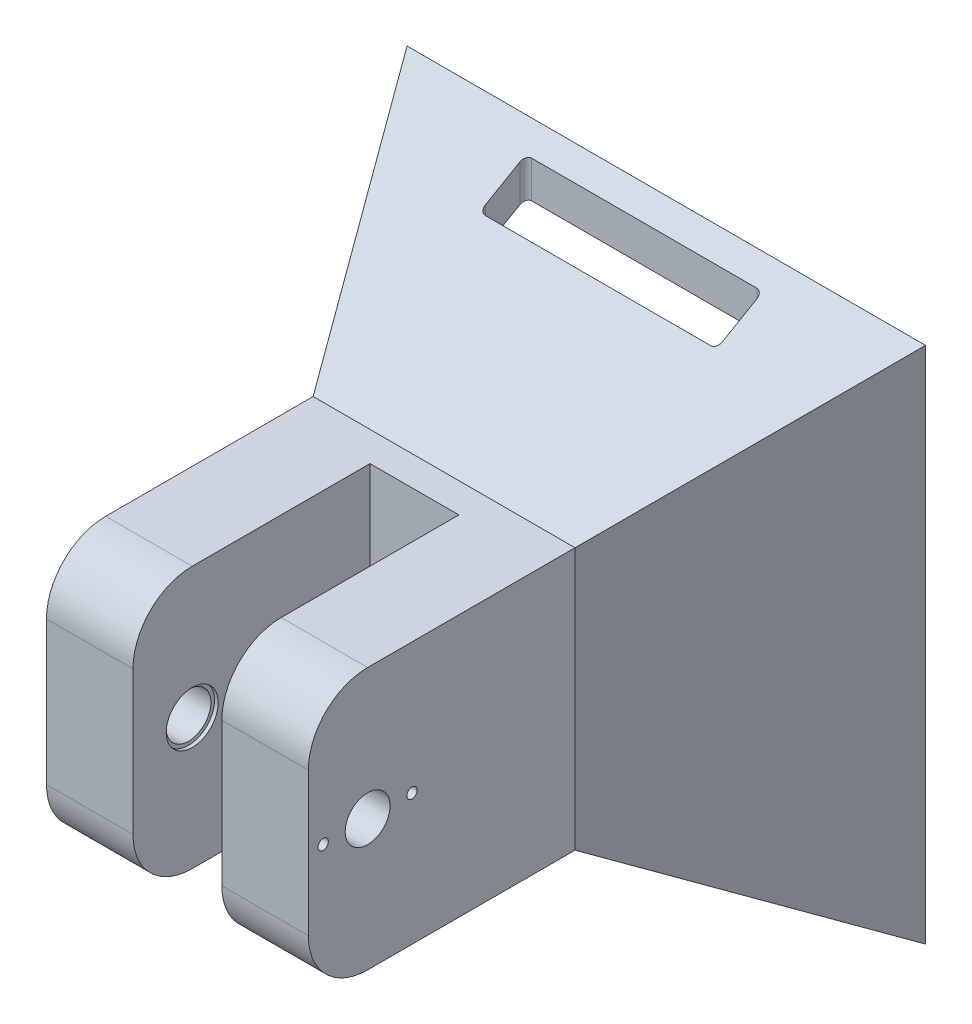
from build123d import *

# Parameters (mm, degrees)
SKETCH2_W           = 175
SKETCH2_H           = 175
BOSS_EXTRUDE1_DEPTH = 75
BOSS_EXTRUDE1_TAPER = 30
SKETCH3_W           = 88.397459622
SKETCH3_H           = 88.397459622
BOSS_EXTRUDE2_DEPTH = 90
SKETCH4_W           = 30
SKETCH4_H           = 88.397459622
CUT_EXTRUDE1_DEPTH  = 80
FILLET1_R           = 20
CUT_EXTRUDE2_REACH  = 276.216
SKETCH5_R           = 7.575
SKETCH6_W           = 150
SKETCH6_H           = 150
CUT_EXTRUDE3_DEPTH  = 60
CUT_EXTRUDE3_DRAFT  = -30
SKETCH8_R           = 1.75
CUT_EXTRUDE5_DEPTH  = 29.198729811
CUT_EXTRUDE6_START  = -3
SKETCH9_R           = 3.25
SKETCH9_R_2         = 1.75
CUT_EXTRUDE6_DEPTH  = 3
SKETCH10_R          = 8.775
CUT_EXTRUDE7_DEPTH  = 1.25
BOSS_EXTRUDE3_REACH = 291.396
SKETCH11_R          = 2.5
SKETCH11_R_2        = 1.05
SKETCH12_W          = 14.5
SKETCH12_H          = 30.5
CUT_EXTRUDE8_DEPTH  = 10.825318
SKETCH13_W          = 25.25
SKETCH13_H          = 45
CUT_EXTRUDE9_DEPTH  = 8.325317547
SKETCH15_R          = 2.5
SKETCH15_R_2        = 1.05
BOSS_EXTRUDE6_DEPTH = 5
SKETCH16_W          = 35
SKETCH16_H          = 14.1
CUT_EXTRUDE10_DEPTH = 10.825317547
CUT_EXTRUDE11_DEPTH = 1
CUT_EXTRUDE12_DEPTH = 1
SKETCH21_R          = 2.55
CUT_EXTRUDE13_DEPTH = 10.825317547
SKETCH22_R          = 3.5
CUT_EXTRUDE14_DEPTH = 5.825317547
CUT_EXTRUDE15_DEPTH = 1
CUT_EXTRUDE16_REACH = 275.103
SKETCH25_W          = 80
SKETCH25_H          = 18
FILLET3_R           = 2


with BuildPart() as part:
    # Sketch2 → Boss-Extrude1 (new body)
    with BuildSketch(Plane.XY):
        with Locations((87.5, 87.5)):
            Rectangle(SKETCH2_W, SKETCH2_H)
    extrude(amount=BOSS_EXTRUDE1_DEPTH, taper=BOSS_EXTRUDE1_TAPER)

    # Sketch3 → Boss-Extrude2 (add)
    with BuildSketch(Plane.XY.offset(75)):
        with Locations((87.5, 87.5)):
            Rectangle(SKETCH3_W, SKETCH3_H)
    extrude(amount=BOSS_EXTRUDE2_DEPTH)

    # Sketch4 → Cut-Extrude1 (cut)
    with BuildSketch(Plane.XY.offset(165)):
        with Locations((87.5, 87.5)):
            Rectangle(SKETCH4_W, SKETCH4_H)
    extrude(amount=-CUT_EXTRUDE1_DEPTH, mode=Mode.SUBTRACT)

    # Fillet1
    fillet1_edges = [part.edges().sort_by_distance(p)[0] for p in [
        (117.099364905, 131.698729811, 165),
        (57.900635095, 43.301270189, 165),
        (57.900635095, 131.698729811, 165),
        (117.099364905, 43.301270189, 165),
    ]]
    fillet(fillet1_edges, radius=FILLET1_R)

    # Cut-Extrude2: up to this face of the body (flat: up to its plane)
    cut_extrude2_end = Plane(part.part.faces().sort_by_distance((131.698729811, 87.5, 119.106035068))[0])
    # Sketch5 → Cut-Extrude2 (cut, up to the picked face)
    with BuildSketch(Plane.ZY.offset(-43.301270189), mode=Mode.PRIVATE) as cut_extrude2_sk1:
        with Locations((145, 87.5)):
            Circle(SKETCH5_R)
    cut_extrude2_tool1 = split(extrude(cut_extrude2_sk1.sketch, amount=-CUT_EXTRUDE2_REACH, mode=Mode.PRIVATE), bisect_by=cut_extrude2_end, keep=Keep.BOTH, mode=Mode.PRIVATE)
    add(cut_extrude2_tool1.solids().sort_by(Axis((43.30127, 87.5, 145), (1, 0, 0)))[0], mode=Mode.SUBTRACT)


with BuildPart() as cut_extrude3_tool:
    # Sketch6 → Cut-Extrude3 (with draft: the straight prism first)
    with BuildSketch(Plane(origin=(0, 0, 0), x_dir=(-1, 0, 0), z_dir=(0, 0, -1))):
        with Locations((-87.5, 87.5)):
            Rectangle(SKETCH6_W, SKETCH6_H)
    extrude(amount=-CUT_EXTRUDE3_DEPTH)
    # Cut-Extrude3: the draft: its side faces are tilted about the plane it starts from
    cut_extrude3_sides = [cut_extrude3_tool.faces().sort_by_distance(p)[0] for p in [
        (87.5, 162.5, 30),
        (162.5, 87.5, 30),
        (87.5, 12.5, 30),
        (12.5, 87.5, 30),
    ]]
    draft(cut_extrude3_sides, Plane(origin=(0, 0, 0), x_dir=(-1, 0, 0), z_dir=(0, 0, -1)), CUT_EXTRUDE3_DRAFT)


with BuildPart() as part_1:
    add(part.part)

    # Cut-Extrude3: cut by cut_extrude3_tool
    add(cut_extrude3_tool.part, mode=Mode.SUBTRACT)

    # Sketch8 → Cut-Extrude5 (cut)
    with BuildSketch(Plane(origin=(131.698729811, 0, 0), x_dir=(0, 0, -1), z_dir=(1, 0, 0))):
        with Locations((-160, 87.5)):
            Circle(SKETCH8_R)
        with Locations((-130, 87.5)):
            Circle(SKETCH8_R)
    extrude(amount=-CUT_EXTRUDE5_DEPTH, mode=Mode.SUBTRACT)

    # Sketch9 → Cut-Extrude6 (cut)
    # profile 1 of 2: a face of its own
    with BuildSketch(Plane.ZY.offset(-102.5).offset(CUT_EXTRUDE6_START)):
        with Locations(Location((160, 87.5, 0), (0, 0, 270))):
            Circle(SKETCH9_R)
        with Locations(Location((160, 87.5, 0), (0, 0, 180))):
            Circle(SKETCH9_R_2, mode=Mode.SUBTRACT)
    # profile 2 of 2: a face of its own
    with BuildSketch(Plane.ZY.offset(-102.5).offset(CUT_EXTRUDE6_START)):
        with Locations(Location((130, 87.5, 0), (0, 0, 270))):
            Circle(SKETCH9_R)
        with Locations(Location((130, 87.5, 0), (0, 0, 180))):
            Circle(SKETCH9_R_2, mode=Mode.SUBTRACT)
    extrude(amount=CUT_EXTRUDE6_DEPTH, mode=Mode.SUBTRACT)

    # Sketch10 → Cut-Extrude7 (cut)
    with BuildSketch(Plane(origin=(72.5, 0, 0), x_dir=(0, 0, -1), z_dir=(1, 0, 0))):
        with Locations(Location((-145, 87.5, 0), (0, 0, 90))):
            Circle(SKETCH10_R)
    cut_extrude7 = extrude(amount=-CUT_EXTRUDE7_DEPTH, mode=Mode.SUBTRACT)

    # Mirror1: Cut-Extrude7 across plane
    add(cut_extrude7.mirror(Plane(origin=(87.5, 0, 0), x_dir=(0, 0, 1), z_dir=(1, 0, 0))), mode=Mode.SUBTRACT)

    # Sketch11 → Boss-Extrude3 (add, up to next)
    with BuildSketch(Plane(origin=(0, 0, 15), x_dir=(-1, 0, 0), z_dir=(0, 0, -1)), mode=Mode.PRIVATE) as boss_extrude3_sk1:
        with Locations((-43.25, 144.75)):
            Circle(SKETCH11_R)
        with Locations((-43.25, 144.75)):
            Circle(SKETCH11_R_2, mode=Mode.SUBTRACT)
    boss_extrude3_tool1 = extrude(boss_extrude3_sk1.sketch, amount=-BOSS_EXTRUDE3_REACH, mode=Mode.PRIVATE) - part_1.part
    # Sketch11 → Boss-Extrude3 (add, up to next)
    with BuildSketch(Plane(origin=(0, 0, 15), x_dir=(-1, 0, 0), z_dir=(0, 0, -1)), mode=Mode.PRIVATE) as boss_extrude3_sk2:
        with Locations((-43.25, 30.25)):
            Circle(SKETCH11_R)
        with Locations((-43.25, 30.25)):
            Circle(SKETCH11_R_2, mode=Mode.SUBTRACT)
    boss_extrude3_tool2 = extrude(boss_extrude3_sk2.sketch, amount=-BOSS_EXTRUDE3_REACH, mode=Mode.PRIVATE) - part_1.part
    # Sketch11 → Boss-Extrude3 (add, up to next)
    with BuildSketch(Plane(origin=(0, 0, 15), x_dir=(-1, 0, 0), z_dir=(0, 0, -1)), mode=Mode.PRIVATE) as boss_extrude3_sk3:
        with Locations((-131.75, 30.25)):
            Circle(SKETCH11_R)
        with Locations((-131.75, 30.25)):
            Circle(SKETCH11_R_2, mode=Mode.SUBTRACT)
    boss_extrude3_tool3 = extrude(boss_extrude3_sk3.sketch, amount=-BOSS_EXTRUDE3_REACH, mode=Mode.PRIVATE) - part_1.part
    # Sketch11 → Boss-Extrude3 (add, up to next)
    with BuildSketch(Plane(origin=(0, 0, 15), x_dir=(-1, 0, 0), z_dir=(0, 0, -1)), mode=Mode.PRIVATE) as boss_extrude3_sk4:
        with Locations((-131.75, 144.75)):
            Circle(SKETCH11_R)
        with Locations((-131.75, 144.75)):
            Circle(SKETCH11_R_2, mode=Mode.SUBTRACT)
    boss_extrude3_tool4 = extrude(boss_extrude3_sk4.sketch, amount=-BOSS_EXTRUDE3_REACH, mode=Mode.PRIVATE) - part_1.part
    add(boss_extrude3_tool1.solids().sort_by_distance((45.679289, 144.75, 15))[0])
    add(boss_extrude3_tool2.solids().sort_by_distance((45.679289, 30.25, 15))[0])
    add(boss_extrude3_tool3.solids().sort_by_distance((134.179289, 30.25, 15))[0])
    add(boss_extrude3_tool4.solids().sort_by_distance((134.179289, 144.75, 15))[0])

    # Sketch12 → Cut-Extrude8 (cut)
    with BuildSketch(Plane(origin=(0, 0, 0), x_dir=(0.500000000000001, 0, 0.8660254037844382), z_dir=(-0.8660254037844382, 0, 0.500000000000001))):
        with Locations((55.352540378, 87.5)):
            Rectangle(SKETCH12_W, SKETCH12_H)
    extrude(amount=-CUT_EXTRUDE8_DEPTH, mode=Mode.SUBTRACT)

    # Sketch13 → Cut-Extrude9 (cut)
    with BuildSketch(Plane(origin=(9.375, 0, -5.412658774), x_dir=(-0.500000000000001, 0, -0.8660254037844382), z_dir=(0.8660254037844382, 0, -0.500000000000001))):
        with Locations((-55.477540378, 88.95)):
            Rectangle(SKETCH13_W, SKETCH13_H)
    extrude(amount=-CUT_EXTRUDE9_DEPTH, mode=Mode.SUBTRACT)

    # Sketch15 → Boss-Extrude6 (add)
    # profile 1 of 4: a face of its own
    with BuildSketch(Plane(origin=(2.165063509, 0, -1.25), x_dir=(-0.500000000000001, 0, -0.8660254037844382), z_dir=(0.8660254037844382, 0, -0.500000000000001))):
        with Locations((-65.352540378, 69.95)):
            Circle(SKETCH15_R)
        with Locations(Location((-65.352540378, 69.95, 0), (0, 0, 180))):
            Circle(SKETCH15_R_2, mode=Mode.SUBTRACT)
    # profile 2 of 4: a face of its own
    with BuildSketch(Plane(origin=(2.165063509, 0, -1.25), x_dir=(-0.500000000000001, 0, -0.8660254037844382), z_dir=(0.8660254037844382, 0, -0.500000000000001))):
        with Locations((-65.352540378, 107.55)):
            Circle(SKETCH15_R)
        with Locations(Location((-65.352540378, 107.55, 0), (0, 0, 180))):
            Circle(SKETCH15_R_2, mode=Mode.SUBTRACT)
    # profile 3 of 4: a face of its own
    with BuildSketch(Plane(origin=(2.165063509, 0, -1.25), x_dir=(-0.500000000000001, 0, -0.8660254037844382), z_dir=(0.8660254037844382, 0, -0.500000000000001))):
        with Locations((-45.852540378, 107.55)):
            Circle(SKETCH15_R)
        with Locations(Location((-45.852540378, 107.55, 0), (0, 0, 180))):
            Circle(SKETCH15_R_2, mode=Mode.SUBTRACT)
    # profile 4 of 4: a face of its own
    with BuildSketch(Plane(origin=(2.165063509, 0, -1.25), x_dir=(-0.500000000000001, 0, -0.8660254037844382), z_dir=(0.8660254037844382, 0, -0.500000000000001))):
        with Locations((-45.852540378, 69.95)):
            Circle(SKETCH15_R)
        with Locations(Location((-45.852540378, 69.95, 0), (0, 0, 180))):
            Circle(SKETCH15_R_2, mode=Mode.SUBTRACT)
    extrude(amount=BOSS_EXTRUDE6_DEPTH)

    # Sketch16 → Cut-Extrude10 (cut)
    with BuildSketch(Plane(origin=(0, 0, 0), x_dir=(0.500000000000001, 0, 0.8660254037844382), z_dir=(-0.8660254037844382, 0, 0.500000000000001))):
        with Locations((55.352540378, 119.8)):
            Rectangle(SKETCH16_W, SKETCH16_H)
    extrude(amount=-CUT_EXTRUDE10_DEPTH, mode=Mode.SUBTRACT)

    # Sketch18 → Cut-Extrude11 (cut)
    with BuildSketch(Plane(origin=(0, 0, 0), x_dir=(0.500000000000001, 0, 0.8660254037844382), z_dir=(-0.8660254037844382, 0, 0.500000000000001))):
        with BuildLine():
            add(Edge.make_bspline(
                [(28.786186835, 119.027708883), (28.762013735, 119.03565442), (28.717097095, 119.050418219), (28.655347344, 119.084049273), (28.608202187, 119.137988943), (28.576963615, 119.214955509), (28.558219073, 119.316376157), (28.55041025, 119.41910525), (28.547703475, 119.517598082), (28.544415654, 119.606730202), (28.54328315, 119.706474747), (28.543451667, 119.776789982), (28.543539776, 119.813554472)],
                knots=[0, 0, 0, 0, 0.853227997, 1.585404248, 2.327728844, 3.204028639, 4.337494252, 5.776073248, 6.65507935, 7.641908083, 8.767065954, 10, 10, 10, 10], degree=3))
            add(Edge.make_bspline(
                [(28.543539776, 119.813554472), (28.543657211, 119.870997925), (28.543874231, 119.977153428), (28.542507934, 120.124251761), (28.546520206, 120.247960107), (28.554236649, 120.35160742), (28.566673916, 120.436196879), (28.580420276, 120.505948947), (28.603771711, 120.560328052), (28.628450551, 120.60595071), (28.658408123, 120.643694217), (28.698783279, 120.668418546), (28.744294022, 120.689579132), (28.777770473, 120.700852589), (28.79583757, 120.706936825)],
                knots=[0, 0, 0, 0, 2.059467181, 3.80589535, 5.273068789, 6.496274407, 7.528476399, 8.339812376, 9.034338485, 9.639247154, 10.200390551, 10.735027596, 11.317299831, 12, 12, 12, 12], degree=3))
            Line((28.79583757, 120.706936825), (34.131315511, 122.507488295))
            add(Edge.make_bspline(
                [(34.131315511, 122.507488295), (34.157480239, 122.515850429), (34.207334658, 122.531783687), (34.277398159, 122.552659521), (34.339584082, 122.566844578), (34.392942026, 122.575684182), (34.43991701, 122.578007407), (34.480602889, 122.571548175), (34.515879085, 122.555935679), (34.544436651, 122.529688387), (34.566386834, 122.493610761), (34.583962265, 122.448789089), (34.597949142, 122.394220997), (34.605044134, 122.328398838), (34.610173587, 122.251117889), (34.614765196, 122.160570037), (34.615071347, 122.056196806), (34.616076195, 121.981751133), (34.616609629, 121.942230942)],
                knots=[0, 0, 0, 0, 1.276355762, 2.43197542, 3.395458565, 4.238016051, 4.942982558, 5.571350733, 6.135081352, 6.709626972, 7.343413771, 8.080936582, 8.940636217, 9.952363374, 11.151167805, 12.540578578, 14.163533357, 16, 16, 16, 16], degree=3))
            add(Edge.make_bspline(
                [(34.616609629, 121.942230942), (34.616912103, 121.908218631), (34.61748039, 121.844316502), (34.613764712, 121.754273625), (34.611714282, 121.676095238), (34.606493304, 121.59231366), (34.597417018, 121.507533225), (34.580193608, 121.425394674), (34.551320425, 121.363883087), (34.505556288, 121.326047673), (34.450216838, 121.301723205), (34.410809602, 121.287121383), (34.389128011, 121.27908756)],
                knots=[0, 0, 0, 0, 1.326876545, 2.492927798, 3.515610309, 4.377966357, 5.768034318, 6.837886548, 7.647952353, 8.359783364, 9.097564041, 10, 10, 10, 10], degree=3))
            Line((34.389128011, 121.27908756), (29.748503011, 119.805282413))
            Line((29.748503011, 119.805282413), (29.748503011, 119.801146383))
            Line((29.748503011, 119.801146383), (34.36982654, 118.371458883))
            add(Edge.make_bspline(
                [(34.36982654, 118.371458883), (34.394439433, 118.365341445), (34.439244482, 118.354205325), (34.498877967, 118.327604031), (34.549274496, 118.289279201), (34.581342913, 118.225876286), (34.604493549, 118.140920333), (34.613326497, 118.052261545), (34.618568139, 117.965266115), (34.620686775, 117.884781804), (34.624352488, 117.792902385), (34.623796569, 117.727621929), (34.623503011, 117.69315006)],
                knots=[0, 0, 0, 0, 0.944726691, 1.719770527, 2.426938946, 3.256610741, 4.309709431, 5.70951628, 6.568626189, 7.56399594, 8.71364849, 10, 10, 10, 10], degree=3))
            add(Edge.make_bspline(
                [(34.623503011, 117.69315006), (34.62376483, 117.659598333), (34.624259886, 117.596157642), (34.621006932, 117.507001056), (34.617648653, 117.429677477), (34.610694225, 117.363841675), (34.601624311, 117.308326614), (34.588606334, 117.261786849), (34.568916421, 117.224581088), (34.536246785, 117.186971283), (34.473677627, 117.16073675), (34.380988034, 117.166126358), (34.265451266, 117.195909988), (34.179829489, 117.224656293), (34.131315511, 117.240944178)],
                knots=[0, 0, 0, 0, 1.282697052, 2.425365087, 3.410762826, 4.241268915, 4.954797808, 5.560685547, 6.079556643, 6.552349078, 7.440867835, 8.547852962, 10.043986091, 12, 12, 12, 12], degree=3))
            Line((34.131315511, 117.240944178), (28.786186835, 119.027708883))
        make_face()
    extrude(amount=-CUT_EXTRUDE11_DEPTH, mode=Mode.SUBTRACT)

    # Sketch20 → Cut-Extrude12 (cut)
    with BuildSketch(Plane(origin=(0, 0, 0), x_dir=(0.500000000000001, 0, 0.8660254037844382), z_dir=(-0.8660254037844382, 0, 0.500000000000001))):
        with BuildLine():
            add(Edge.make_bspline(
                [(80.590099514, 118.0602636), (80.547348394, 118.060741982), (80.468643882, 118.061622681), (80.361169182, 118.068956242), (80.273957737, 118.08318716), (80.206563638, 118.10490738), (80.155964695, 118.131536339), (80.119207302, 118.162162167), (80.096639613, 118.199391301), (80.093785802, 118.226366855), (80.092397308, 118.239491541)],
                knots=[0, 0, 0, 0, 1.787146014, 3.290123227, 4.499880609, 5.471948657, 6.237066405, 6.876863787, 7.453549351, 8, 8, 8, 8], degree=3))
            Line((80.092397308, 118.239491541), (80.088261279, 120.208241541))
            Line((80.088261279, 120.208241541), (78.468316426, 120.205484188))
            Line((78.468316426, 120.205484188), (78.472452455, 118.358057717))
            add(Edge.make_bspline(
                [(78.472452455, 118.358057717), (78.471448347, 118.345006841), (78.469412277, 118.318543054), (78.450247323, 118.280907834), (78.415185022, 118.24940845), (78.365892714, 118.222166837), (78.299177766, 118.200370991), (78.214250179, 118.186305961), (78.108625524, 118.178654389), (78.031290771, 118.177879493), (77.988537014, 118.1774511)],
                knots=[0, 0, 0, 0, 0.552716134, 1.120764747, 1.742723911, 2.530465603, 3.500675299, 4.711930986, 6.182223433, 8, 8, 8, 8], degree=3))
            add(Edge.make_bspline(
                [(77.988537014, 118.1774511), (77.945805553, 118.178130628), (77.868086358, 118.179366541), (77.761791688, 118.184304007), (77.675353234, 118.199703381), (77.605803638, 118.22085161), (77.553052922, 118.247913683), (77.514321439, 118.278583347), (77.49566355, 118.317362195), (77.492432667, 118.343668866), (77.490834808, 118.356679041)],
                knots=[0, 0, 0, 0, 1.782778602, 3.242484939, 4.430420112, 5.436549113, 6.259539039, 6.897772888, 7.454884763, 8, 8, 8, 8], degree=3))
            Line((77.490834808, 118.356679041), (77.486698779, 120.204105511))
            Line((77.486698779, 120.204105511), (75.243592161, 120.199969482))
            add(Edge.make_bspline(
                [(75.243592161, 120.199969482), (75.22777258, 120.201278787), (75.196513035, 120.203865979), (75.151192588, 120.226019496), (75.116194187, 120.270529172), (75.087590116, 120.333182981), (75.067237296, 120.417404119), (75.050427511, 120.524742666), (75.042156619, 120.65987504), (75.040476302, 120.759708264), (75.039548043, 120.814859188)],
                knots=[0, 0, 0, 0, 0.537722509, 1.062541484, 1.661642772, 2.424508068, 3.396140002, 4.600050277, 6.121763879, 8, 8, 8, 8], degree=3))
            add(Edge.make_bspline(
                [(75.039548043, 120.814859188), (75.039856772, 120.869101348), (75.0404173, 120.967583529), (75.049413331, 121.101691363), (75.065411374, 121.208779701), (75.086552616, 121.292658527), (75.114617891, 121.355391586), (75.150589943, 121.398987882), (75.194329672, 121.425115664), (75.226270183, 121.427286587), (75.242213485, 121.428370217)],
                knots=[0, 0, 0, 0, 1.854072043, 3.366257086, 4.590545859, 5.550927336, 6.316870981, 6.918389789, 7.460107648, 8, 8, 8, 8], degree=3))
            Line((75.242213485, 121.428370217), (80.700393632, 121.438020953))
            add(Edge.make_bspline(
                [(80.700393632, 121.438020953), (80.732195183, 121.436727856), (80.791871342, 121.434301337), (80.874843348, 121.415870635), (80.943496274, 121.382218885), (80.997234507, 121.335358883), (81.036814892, 121.279267131), (81.067004731, 121.217594396), (81.083353397, 121.148871099), (81.085382185, 121.101243026), (81.086423043, 121.076807717)],
                knots=[0, 0, 0, 0, 1.270617856, 2.384336326, 3.369991149, 4.294361915, 5.201790585, 6.097244414, 7.023802181, 8, 8, 8, 8], degree=3))
            Line((81.086423043, 121.076807717), (81.091937749, 118.242248894))
            add(Edge.make_bspline(
                [(81.091937749, 118.242248894), (81.090458669, 118.229171139), (81.087443996, 118.202515966), (81.066802417, 118.164980269), (81.03038905, 118.133667033), (80.979453071, 118.106025566), (80.909721526, 118.084870297), (80.821493275, 118.068574953), (80.712441936, 118.061740295), (80.633298754, 118.060785022), (80.590099514, 118.0602636)],
                knots=[0, 0, 0, 0, 0.540963951, 1.102596549, 1.721819432, 2.505081308, 3.485450921, 4.723896687, 6.211783092, 8, 8, 8, 8], degree=3))
        make_face()
    extrude(amount=-CUT_EXTRUDE12_DEPTH, mode=Mode.SUBTRACT)

    # Sketch21 → Cut-Extrude13 (cut)
    with BuildSketch(Plane(origin=(0, 0, 0), x_dir=(0.500000000000001, 0, 0.8660254037844382), z_dir=(-0.8660254037844382, 0, 0.500000000000001))):
        with Locations((67.852540378, 62.25)):
            Circle(SKETCH21_R)
        with Locations((42.852540378, 62.25)):
            Circle(SKETCH21_R)
    extrude(amount=-CUT_EXTRUDE13_DEPTH, mode=Mode.SUBTRACT)

    # Sketch22 → Cut-Extrude14 (cut)
    with BuildSketch(Plane(origin=(9.375, 0, -5.412658774), x_dir=(-0.500000000000001, 0, -0.8660254037844382), z_dir=(0.8660254037844382, 0, -0.500000000000001))):
        with Locations((-42.852540378, 62.25)):
            Circle(SKETCH22_R)
        with Locations((-67.852540378, 62.25)):
            Circle(SKETCH22_R)
    extrude(amount=-CUT_EXTRUDE14_DEPTH, mode=Mode.SUBTRACT)

    # Sketch24 → Cut-Extrude15 (cut)
    # profile 1 of 2: a face of its own
    with BuildSketch(Plane(origin=(0, 0, 0), x_dir=(0.500000000000001, 0, 0.8660254037844382), z_dir=(-0.8660254037844382, 0, 0.500000000000001))):
        with BuildLine():
            add(Edge.make_bspline(
                [(45.21359903, 52.30831695), (45.131222487, 52.309872988), (44.970931107, 52.312900786), (44.738142959, 52.344958599), (44.519178998, 52.391587191), (44.315277958, 52.460924278), (44.127260337, 52.549865303), (43.952767858, 52.654615928), (43.79507385, 52.77992596), (43.651916729, 52.922343183), (43.52652421, 53.083893933), (43.415045168, 53.261232138), (43.322074845, 53.457019386), (43.24267797, 53.669397682), (43.181096359, 53.900233822), (43.137288368, 54.150222769), (43.111390139, 54.419445724), (43.107573294, 54.605593592), (43.105602706, 54.701699303)],
                knots=[0, 0, 0, 0, 1.088899274, 2.118821234, 3.102520409, 4.04634752, 4.959998216, 5.849240045, 6.732122544, 7.617554255, 8.513749535, 9.431274385, 10.382821295, 11.375289566, 12.426622076, 13.537923986, 14.728862333, 16, 16, 16, 16], degree=3))
            Line((43.105602706, 54.701699303), (43.10422403, 55.203537538))
            Line((43.10422403, 55.203537538), (41.183727706, 55.199401509))
            add(Edge.make_bspline(
                [(41.183727706, 55.199401509), (41.168788701, 55.201230791), (41.138652201, 55.204921008), (41.095720546, 55.22855052), (41.061821495, 55.272812598), (41.034957303, 55.335177791), (41.015824927, 55.418805364), (40.998822249, 55.525087533), (40.990538802, 55.65976645), (40.988877585, 55.759140698), (40.987955647, 55.814291215)],
                knots=[0, 0, 0, 0, 0.514984792, 1.038880434, 1.634304517, 2.398805223, 3.361734029, 4.578766947, 6.101291073, 8, 8, 8, 8], degree=3))
            add(Edge.make_bspline(
                [(40.987955647, 55.814291215), (40.988297012, 55.868524331), (40.988916794, 55.966990089), (40.997553501, 56.101197507), (41.014596659, 56.208335331), (41.033068255, 56.292663776), (41.060417665, 56.354515532), (41.094448474, 56.397484392), (41.137499238, 56.419583267), (41.167439208, 56.422308883), (41.18234903, 56.423666215)],
                knots=[0, 0, 0, 0, 1.87556391, 3.405277764, 4.643758138, 5.626644271, 6.380315985, 6.96639604, 7.485275036, 8, 8, 8, 8], degree=3))
            Line((41.18234903, 56.423666215), (46.597790206, 56.43331695))
            add(Edge.make_bspline(
                [(46.597790206, 56.43331695), (46.632381178, 56.432197597), (46.69722252, 56.430099351), (46.788187569, 56.409309138), (46.865681737, 56.373961069), (46.92747782, 56.322223159), (46.977099567, 56.261317775), (47.009866589, 56.188468444), (47.031358532, 56.107802632), (47.033646927, 56.050654007), (47.034830647, 56.021092685)],
                knots=[0, 0, 0, 0, 1.21412933, 2.275905221, 3.258558413, 4.176841113, 5.084981468, 5.995417283, 6.963087681, 8, 8, 8, 8], degree=3))
            Line((47.034830647, 56.021092685), (47.037588, 54.601055921))
            add(Edge.make_bspline(
                [(47.037588, 54.601055921), (47.036706273, 54.531648486), (47.034982562, 54.395962194), (47.025692901, 54.226318228), (47.013409662, 54.089276944), (46.997209852, 53.978202973), (46.97843187, 53.85714751), (46.953819059, 53.727820742), (46.923649622, 53.592502434), (46.878437297, 53.456038548), (46.823500403, 53.318222283), (46.757919857, 53.181733376), (46.682807385, 53.049019804), (46.596034351, 52.925703991), (46.500364271, 52.811000532), (46.394022871, 52.708225572), (46.279476602, 52.61470533), (46.154139501, 52.534766917), (46.020120276, 52.465317152), (45.876300287, 52.408985144), (45.723392903, 52.365123071), (45.561787902, 52.331500685), (45.390521938, 52.312505306), (45.2733865, 52.309732319), (45.21359903, 52.30831695)],
                knots=[0, 0, 0, 0, 1.374044877, 2.68615396, 3.362399503, 4.097074694, 4.907752953, 5.787425126, 6.703239164, 7.649808054, 8.629675364, 9.638838635, 10.645414988, 11.644894551, 12.619892662, 13.597815202, 14.5682609, 15.542367225, 16.535199581, 17.5522469, 18.594495656, 19.68110682, 20.816406386, 22, 22, 22, 22], degree=3))
        make_face()
        with BuildLine():
            add(Edge.make_bspline(
                [(45.122606382, 53.587728715), (45.172752943, 53.589592182), (45.269349891, 53.593181765), (45.407662569, 53.612692146), (45.531620006, 53.649055148), (45.641957512, 53.697395064), (45.737663933, 53.757039535), (45.821788265, 53.82173982), (45.89198465, 53.893930805), (45.96384295, 53.99879177), (46.03185348, 54.138188162), (46.072228141, 54.317507142), (46.090339669, 54.500434949), (46.092235168, 54.623992431), (46.093194618, 54.686533862)],
                knots=[0, 0, 0, 0, 1.070890041, 2.062847548, 2.972414921, 3.820043133, 4.625943075, 5.373616765, 6.081285573, 6.764390633, 8.080700004, 9.363126379, 10.665286415, 12, 12, 12, 12], degree=3))
            Line((46.093194618, 54.686533862), (46.091815941, 55.207673568))
            Line((46.091815941, 55.207673568), (44.049996088, 55.204916215))
            Line((44.049996088, 55.204916215), (44.051374765, 54.65620298))
            add(Edge.make_bspline(
                [(44.051374765, 54.65620298), (44.052610065, 54.609302339), (44.05497729, 54.519425884), (44.067988698, 54.390037451), (44.092771756, 54.272744958), (44.126861007, 54.166550169), (44.172190706, 54.072161446), (44.223025277, 53.985703351), (44.282315439, 53.907937644), (44.373327092, 53.817617012), (44.507175147, 53.723708312), (44.692889796, 53.643758692), (44.901613839, 53.597294618), (45.0474655, 53.59098127), (45.122606382, 53.587728715)],
                knots=[0, 0, 0, 0, 0.979517062, 1.877064381, 2.710789446, 3.478508041, 4.199657845, 4.892480384, 5.569982611, 6.234932968, 7.563482879, 8.95579031, 10.431662677, 12, 12, 12, 12], degree=3))
        make_face(mode=Mode.SUBTRACT)
    # profile 2 of 2: a face of its own
    with BuildSketch(Plane(origin=(0, 0, 0), x_dir=(0.500000000000001, 0, 0.8660254037844382), z_dir=(-0.8660254037844382, 0, 0.500000000000001))):
        with BuildLine():
            add(Edge.make_bspline(
                [(66.110198294, 52.260063274), (66.074348968, 52.260189268), (66.008112434, 52.260422061), (65.916448723, 52.265474661), (65.83966742, 52.275413815), (65.774815058, 52.287135459), (65.720025331, 52.304250214), (65.67000832, 52.324692966), (65.624009971, 52.359019618), (65.58132, 52.392762565), (65.544800141, 52.433117196), (65.51329794, 52.477298245), (65.475850587, 52.531775912), (65.420997886, 52.62625821), (65.349298239, 52.766475843), (65.271571723, 52.962467815), (65.202351468, 53.189768865), (65.142426798, 53.445218829), (65.102851712, 53.728074496), (65.098911399, 53.925367418), (65.096871088, 54.027526509)],
                knots=[0, 0, 0, 0, 0.843545057, 1.55856486, 2.158121098, 2.664986936, 3.106237337, 3.508097386, 3.92802909, 4.450011603, 4.786805227, 5.204223184, 5.726093672, 6.341815427, 7.773326184, 9.427977642, 11.295541671, 13.359956504, 15.5973663, 18, 18, 18, 18], degree=3))
            add(Edge.make_bspline(
                [(65.096871088, 54.027526509), (65.098658748, 54.128284927), (65.102156348, 54.325421293), (65.139190649, 54.613324067), (65.198037473, 54.886155822), (65.280248827, 55.144023089), (65.388159815, 55.384121281), (65.5182246, 55.607418206), (65.673619503, 55.810443197), (65.851795994, 55.995847811), (66.05385066, 56.161711574), (66.280290462, 56.306927384), (66.53006138, 56.431229481), (66.803212699, 56.534078564), (67.09943339, 56.617919785), (67.419679339, 56.673335411), (67.762352241, 56.710732576), (67.998417292, 56.715079688), (68.120308588, 56.717324303)],
                knots=[0, 0, 0, 0, 1.050447396, 2.055226624, 3.021752817, 3.958558603, 4.872571995, 5.762074083, 6.647913602, 7.532715017, 8.438597849, 9.367991905, 10.332638274, 11.343049883, 12.408385662, 13.538522799, 14.729025559, 16, 16, 16, 16], degree=3))
            add(Edge.make_bspline(
                [(68.120308588, 56.717324303), (68.244944486, 56.715058257), (68.487448291, 56.710649215), (68.840242321, 56.673170679), (69.171696327, 56.610538872), (69.480881648, 56.520341995), (69.768213652, 56.409416808), (70.032044566, 56.276589516), (70.272118835, 56.123086365), (70.488370829, 55.949055345), (70.679397265, 55.754494352), (70.847713154, 55.5432368), (70.989071332, 55.311658987), (71.10597496, 55.063290651), (71.198485531, 54.799495056), (71.264499249, 54.52186581), (71.305503182, 54.230953158), (71.310683692, 54.032258932), (71.313323294, 53.931019156)],
                knots=[0, 0, 0, 0, 1.249457996, 2.431067821, 3.552594302, 4.627366555, 5.655943198, 6.636874941, 7.584041511, 8.50808166, 9.413926972, 10.312783414, 11.21057619, 12.127847145, 13.060555756, 14.008327423, 14.98519202, 16, 16, 16, 16], degree=3))
            add(Edge.make_bspline(
                [(71.313323294, 53.931019156), (71.311811782, 53.848639699), (71.308836057, 53.686458737), (71.275313591, 53.450084276), (71.227372132, 53.227312071), (71.166923688, 53.020406386), (71.096100265, 52.831383009), (71.02686063, 52.688915122), (70.967863051, 52.590145986), (70.930364201, 52.527152201), (70.893250861, 52.477789942), (70.851352492, 52.430726079), (70.806271354, 52.388275946), (70.755291232, 52.351882935), (70.702484008, 52.329324904), (70.643037593, 52.313546439), (70.571982696, 52.301253668), (70.487628623, 52.293588674), (70.386922389, 52.288053331), (70.313792544, 52.286892779), (70.273801235, 52.286258127)],
                knots=[0, 0, 0, 0, 2.010126438, 3.957348714, 5.817121729, 7.571218606, 9.215533078, 10.741118384, 11.430102472, 12.024824996, 12.529778082, 12.935140772, 13.562423786, 14.038630346, 14.455629675, 14.956577121, 15.537699906, 16.214328667, 17.023499443, 18, 18, 18, 18], degree=3))
            add(Edge.make_bspline(
                [(70.273801235, 52.286258127), (70.231079298, 52.287123679), (70.152028592, 52.288725258), (70.042987207, 52.291686822), (69.953664089, 52.306201302), (69.881713181, 52.323577064), (69.828596635, 52.350342845), (69.788799839, 52.379424185), (69.766383447, 52.41761282), (69.763660335, 52.445023228), (69.762312265, 52.458592685)],
                knots=[0, 0, 0, 0, 1.750427523, 3.238910454, 4.457839767, 5.453032084, 6.252496953, 6.881405314, 7.446242365, 8, 8, 8, 8], degree=3))
            add(Edge.make_bspline(
                [(69.762312265, 52.458592685), (69.763615957, 52.471124631), (69.766445845, 52.498327356), (69.783575484, 52.540305775), (69.808188831, 52.587133036), (69.859307121, 52.659019007), (69.935129675, 52.76554249), (70.029627106, 52.918962369), (70.12479775, 53.104344714), (70.194723037, 53.282175507), (70.242326492, 53.44184462), (70.266310039, 53.577328678), (70.28166528, 53.72340191), (70.283751879, 53.824818555), (70.284830647, 53.877250774)],
                knots=[0, 0, 0, 0, 0.293306239, 0.636671247, 1.050074626, 1.529924894, 2.695496958, 4.109104867, 5.738306607, 7.562201128, 8.5688812, 9.629029267, 10.774212491, 12, 12, 12, 12], degree=3))
            add(Edge.make_bspline(
                [(70.284830647, 53.877250774), (70.283015949, 53.935740003), (70.27947963, 54.049718511), (70.250702173, 54.215725491), (70.20631162, 54.372398184), (70.140174949, 54.518176911), (70.058247385, 54.653823235), (69.961531562, 54.780473816), (69.847428138, 54.895032375), (69.718402213, 54.999000762), (69.574249404, 55.091036419), (69.416312675, 55.17309425), (69.243354304, 55.241464385), (69.056980567, 55.297835545), (68.857248621, 55.341248669), (68.645668033, 55.375157046), (68.421131108, 55.391945154), (68.267848541, 55.394990523), (68.189242412, 55.396552244)],
                knots=[0, 0, 0, 0, 0.964162687, 1.878872853, 2.771228925, 3.643263029, 4.510374175, 5.38066035, 6.265093123, 7.170743873, 8.108531658, 9.081563328, 10.102095998, 11.171593821, 12.289788317, 13.471249727, 14.703210191, 16, 16, 16, 16], degree=3))
            add(Edge.make_bspline(
                [(68.189242412, 55.396552244), (68.103701723, 55.395510391), (67.938288305, 55.393495719), (67.69899397, 55.37009958), (67.477071327, 55.337301464), (67.273030561, 55.288438516), (67.086285825, 55.228658907), (66.91715256, 55.155035788), (66.76458753, 55.071485183), (66.629582477, 54.975600985), (66.511195383, 54.868998067), (66.409780836, 54.750512413), (66.32376693, 54.622011497), (66.254647218, 54.482743681), (66.200748229, 54.33426154), (66.162042703, 54.176708692), (66.14028083, 54.010210032), (66.136793814, 53.896613484), (66.135014471, 53.838647833)],
                knots=[0, 0, 0, 0, 1.402654468, 2.712368516, 3.940600608, 5.079726948, 6.150104347, 7.152828865, 8.101024302, 8.998382471, 9.862971687, 10.707612296, 11.550198348, 12.393020423, 13.251541346, 14.136464389, 15.049081535, 16, 16, 16, 16], degree=3))
            add(Edge.make_bspline(
                [(66.135014471, 53.838647833), (66.136076694, 53.786212809), (66.138140555, 53.684333498), (66.153863287, 53.537476992), (66.176267323, 53.401201106), (66.220291095, 53.239997094), (66.286895322, 53.061697587), (66.375701549, 52.875061958), (66.467720089, 52.723343627), (66.534528866, 52.613360017), (66.583858272, 52.541912904), (66.60741979, 52.496193073), (66.622821272, 52.456347974), (66.624904763, 52.431114303), (66.625823294, 52.419989744)],
                knots=[0, 0, 0, 0, 1.236865092, 2.403183109, 3.481668608, 4.491642336, 6.340719237, 7.965364236, 9.360115665, 10.52441583, 11.002616421, 11.405124789, 11.737742306, 12, 12, 12, 12], degree=3))
            add(Edge.make_bspline(
                [(66.625823294, 52.419989744), (66.625389233, 52.406065153), (66.624575084, 52.379947384), (66.608660117, 52.343549316), (66.57579413, 52.316222487), (66.527436298, 52.295096724), (66.458764708, 52.279627687), (66.367938606, 52.267485157), (66.249052876, 52.261612228), (66.16029237, 52.260622085), (66.110198294, 52.260063274)],
                knots=[0, 0, 0, 0, 0.5618397, 1.053819046, 1.555236867, 2.255478343, 3.177489526, 4.400323496, 5.968438027, 8, 8, 8, 8], degree=3))
        make_face()
    extrude(amount=-CUT_EXTRUDE15_DEPTH, mode=Mode.SUBTRACT)

    # Cut-Extrude16: up to this plane
    cut_extrude16_end = Plane(origin=(0, 0, 0), z_dir=(0, -0.866025403784438, 0.500000000000001))
    # Sketch25 → Cut-Extrude16 (cut, up to the surface)
    with BuildSketch(Plane(origin=(0, 131.25, 75.777222831), x_dir=(1, 0, 0), z_dir=(0, 0.8660254037844382, 0.500000000000001)), mode=Mode.PRIVATE) as cut_extrude16_sk1:
        with Locations((87.5, 69.897459622)):
            Rectangle(SKETCH25_W, SKETCH25_H)
    cut_extrude16_tool1 = split(extrude(cut_extrude16_sk1.sketch, amount=CUT_EXTRUDE16_REACH, dir=(0, -1, 0), mode=Mode.PRIVATE), bisect_by=cut_extrude16_end, keep=Keep.BOTH, mode=Mode.PRIVATE)
    add(cut_extrude16_tool1.solids().sort_by_distance((87.5, 166.19873, 15.244247))[0], mode=Mode.SUBTRACT)

    # Fillet3
    fillet3_edges = [part_1.edges().sort_by_distance(p)[0] for p in [
        (127.5, 10.551270189, 7.450018505),
        (127.5, 164.448729811, 7.450018505),
        (127.5, 19.551270189, 23.038475773),
        (127.5, 155.448729811, 23.038475773),
        (47.5, 19.551270189, 23.038475773),
        (47.5, 155.448729811, 23.038475773),
        (47.5, 10.551270189, 7.450018505),
        (47.5, 164.448729811, 7.450018505),
    ]]
    fillet(fillet3_edges, radius=FILLET3_R)


solid = part_1.part
